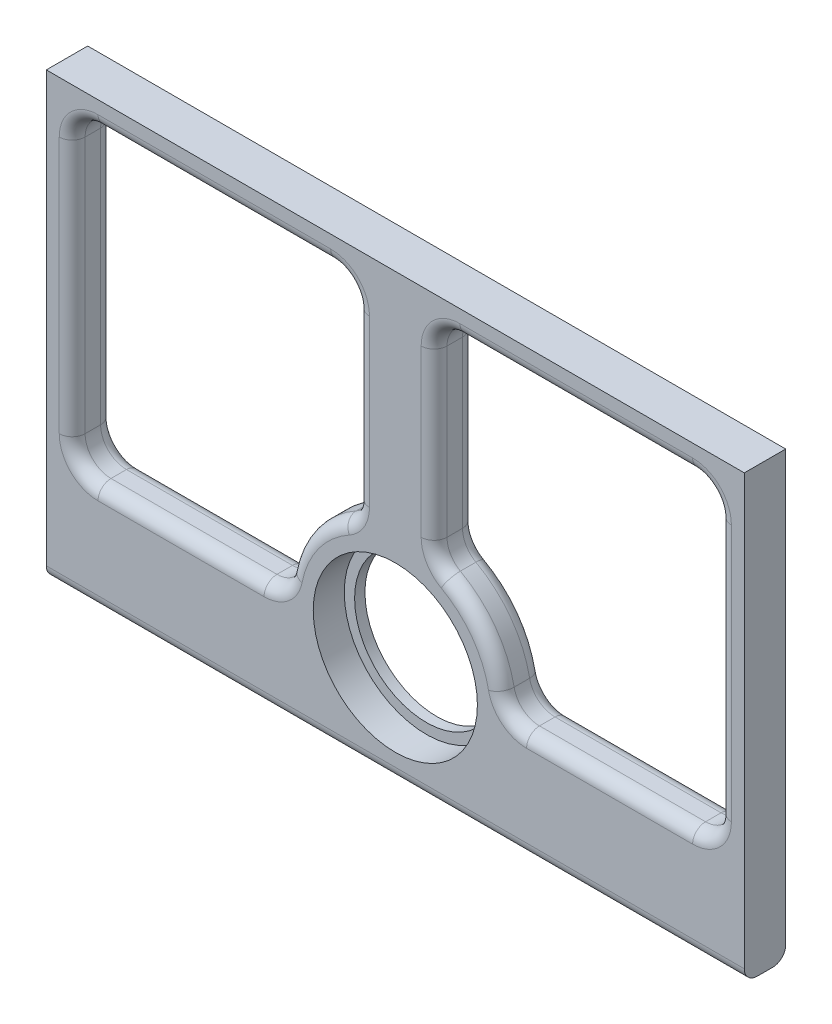
from build123d import *

# Parameters (mm, degrees)
SKETCH1_R            = 41.75
SKETCH1_R_2          = 31.75
BEARING_HOLDER_DEPTH = 16
SKETCH2_R            = 31.75
SKETCH2_R_2          = 27.75
BEARING_LIP_DEPTH    = 4
BOX_START            = -16
BOX_ADAPTER_DEPTH    = 16
STRUCTURAL_FILLETS_R = 10
SMALLER_FILLETS_R    = 5


with BuildPart() as part:
    # Sketch1 → Bearing holder (new body)
    with BuildSketch(Plane.XY):
        Circle(SKETCH1_R)
        Circle(SKETCH1_R_2, mode=Mode.SUBTRACT)
    extrude(amount=BEARING_HOLDER_DEPTH)

    # Sketch2 → Bearing lip (add)
    with BuildSketch(Plane(origin=(0, 0, 0), x_dir=(-1, 0, 0), z_dir=(0, 0, -1))):
        Circle(SKETCH2_R)
        Circle(SKETCH2_R_2, mode=Mode.SUBTRACT)
    extrude(amount=-BEARING_LIP_DEPTH)

    # Sketch3 → Box adapter (add)
    with BuildSketch(Plane.XY.offset(16).offset(BOX_START)):
        Polygon((-135, -41.75), (-125, -41.75), (-41.75, -41.75), (41.75, -41.75), (125, -41.75), (135, -41.75), (135, 129.38), (-135, 129.38), align=None)
        with BuildLine():
            Line((-125, 0), (-125, 119.38))
            Line((-125, 119.38), (-15, 119.38))
            Line((-15, 119.38), (-15, 38.962321543))
            ThreePointArc((-15, 38.962321543), (0, 41.75), (15, 38.962321543))
            Line((15, 38.962321543), (15, 119.38))
            Line((15, 119.38), (125, 119.38))
            Line((125, 119.38), (125, 0))
            Line((125, 0), (41.75, 0))
            Line((41.75, 0), (36.75, 0))
            ThreePointArc((36.75, 0), (0, -36.75), (-36.75, 0))
            Line((-36.75, 0), (-41.75, 0))
            Line((-41.75, 0), (-125, 0))
        make_face(mode=Mode.SUBTRACT)
    extrude(amount=BOX_ADAPTER_DEPTH)

    # Structural fillets
    structural_fillets_edges = [part.edges().sort_by_distance(p)[0] for p in [
        (-41.75, 0, 8),
        (41.75, 0, 8),
        (-125, 0, 8),
        (-15, 119.38, 8),
        (-15, 38.962321543, 8),
        (15, 38.962321543, 8),
        (15, 119.38, 8),
        (125, 119.38, 8),
        (125, 0, 8),
        (-125, 119.38, 8),
    ]]
    fillet(structural_fillets_edges, radius=STRUCTURAL_FILLETS_R)

    # Smaller fillets
    smaller_fillets_edges = [part.edges().sort_by_distance(p)[0] for p in [
        (122.071067812, 2.928932188, 16),
        (122.071067812, 2.928932188, 0),
        (-17.928932188, 116.451067812, 16),
        (-17.928932188, 116.451067812, 0),
        (122.071067812, 116.451067812, 16),
        (122.071067812, 116.451067812, 0),
        (17.928932188, 116.451067812, 16),
        (17.928932188, 116.451067812, 0),
        (-122.071067812, 116.451067812, 16),
        (-122.071067812, 116.451067812, 0),
        (0, -41.75, 0),
        (0, -41.75, 16),
        (82.887312284, 0, 0),
        (82.887312284, 0, 16),
        (33.72193708, 24.6149032, 16),
        (33.72193708, 24.6149032, 0),
        (15, 77.345366362, 16),
        (15, 77.345366362, 0),
        (-82.887312284, 0, 16),
        (-82.887312284, 0, 0),
        (-33.72193708, 24.6149032, 0),
        (-33.72193708, 24.6149032, 16),
        (-15, 77.345366362, 16),
        (-15, 77.345366362, 0),
        (-125, 59.69, 16),
        (-125, 59.69, 0),
        (125, 59.69, 16),
        (125, 59.69, 0),
        (-70, 119.38, 16),
        (-70, 119.38, 0),
        (70, 119.38, 16),
        (70, 119.38, 0),
        (44.423391282, 2.27589256, 16),
        (44.423391282, 2.27589256, 0),
        (16.388694096, 40.226894545, 16),
        (16.388694096, 40.226894545, 0),
        (-44.423391282, 2.27589256, 0),
        (-44.423391282, 2.27589256, 16),
        (-16.388694096, 40.226894545, 16),
        (-16.388694096, 40.226894545, 0),
        (-122.071067812, 2.928932188, 16),
        (-122.071067812, 2.928932188, 0),
    ]]
    fillet(smaller_fillets_edges, radius=SMALLER_FILLETS_R)


solid = part.part
